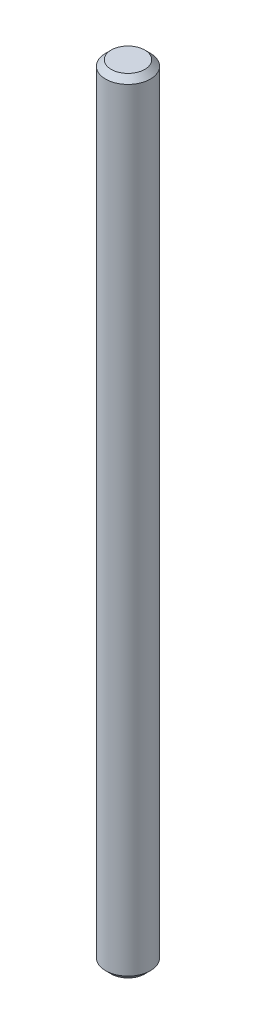
from build123d import *

# Parameters (mm, degrees)
SKETCH2_R           = 4
BOSS_EXTRUDE2_DEPTH = 140
CHAMFER1_SIZE       = 1


with BuildPart() as part:
    # Sketch2 → Boss-Extrude2 (new body)
    with BuildSketch(Plane(origin=(0, 0, 0), x_dir=(1, 0, 0), z_dir=(0, 1, 0))):
        with Locations(Location((0, 0, 0), (0, 0, 270))):
            Circle(SKETCH2_R)
    extrude(amount=BOSS_EXTRUDE2_DEPTH)

    # Chamfer1
    chamfer1_edges = [part.edges().sort_by_distance(p)[0] for p in [
        (0, 0, -4),
        (0, 140, -4),
    ]]
    chamfer(chamfer1_edges, length=CHAMFER1_SIZE)


solid = part.part
